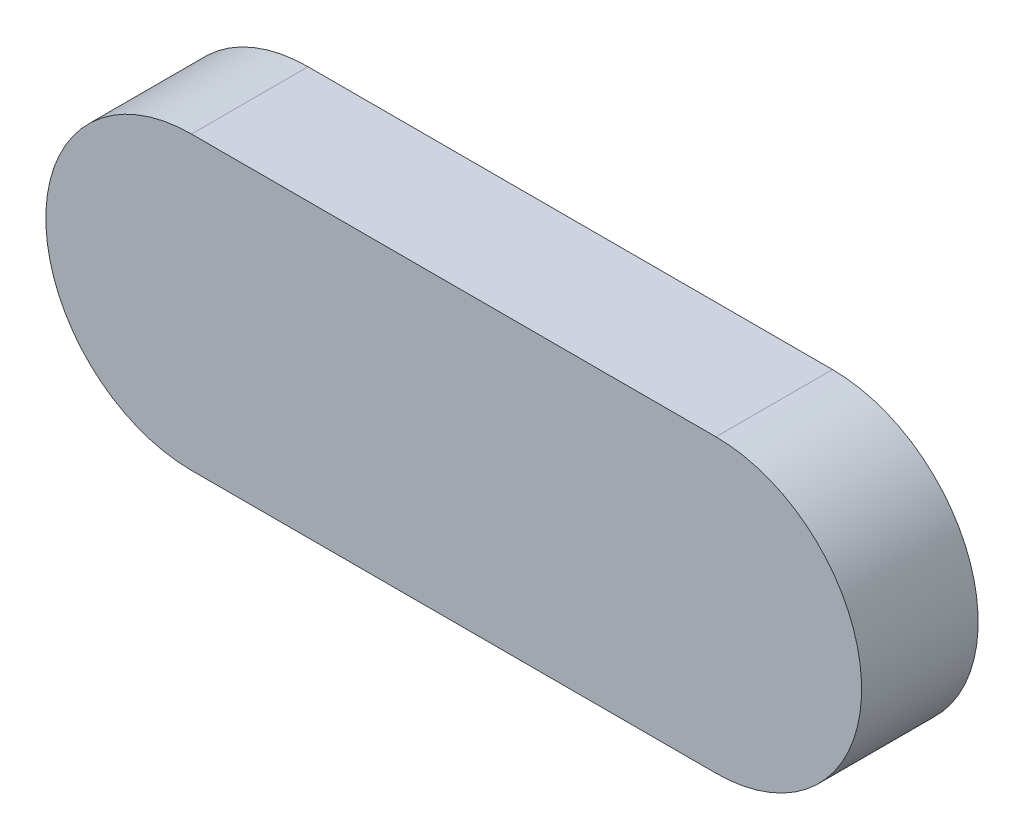
from build123d import *

# Parameters (mm, degrees)
ESTRUSIONE_ESTRUSIONE1_DEPTH = 8


with BuildPart() as part:
    # Schizzo1 → Estrusione-Estrusione1 (new body)
    with BuildSketch(Plane.XY):
        with BuildLine():
            Line((0, 10), (36, 10))
            ThreePointArc((36, 10), (46, 0), (36, -10))
            Line((36, -10), (0, -10))
            ThreePointArc((0, -10), (-10, 0), (0, 10))
        make_face()
    extrude(amount=ESTRUSIONE_ESTRUSIONE1_DEPTH)


solid = part.part
